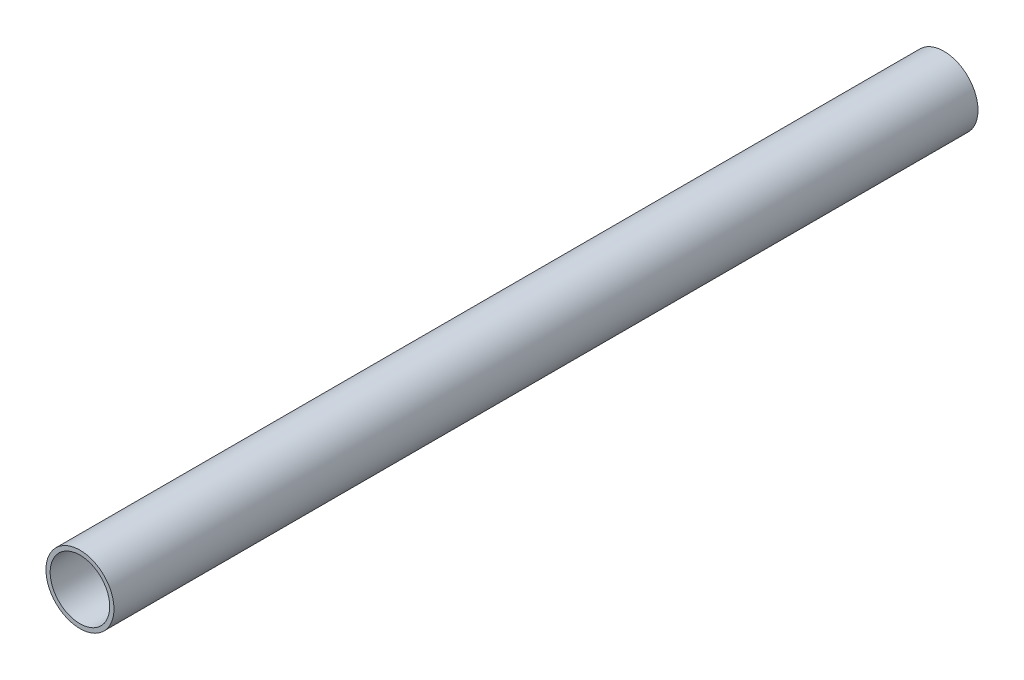
from build123d import *

# Parameters (mm, degrees)
SKETCH1_R           = 8
SKETCH1_R_2         = 7
BOSS_EXTRUDE1_DEPTH = 101.6


with BuildPart() as part:
    # Sketch1 → Boss-Extrude1 (new, symmetric)
    with BuildSketch(Plane.XY):
        Circle(SKETCH1_R)
        Circle(SKETCH1_R_2, mode=Mode.SUBTRACT)
    extrude(amount=BOSS_EXTRUDE1_DEPTH, both=True)


solid = part.part
